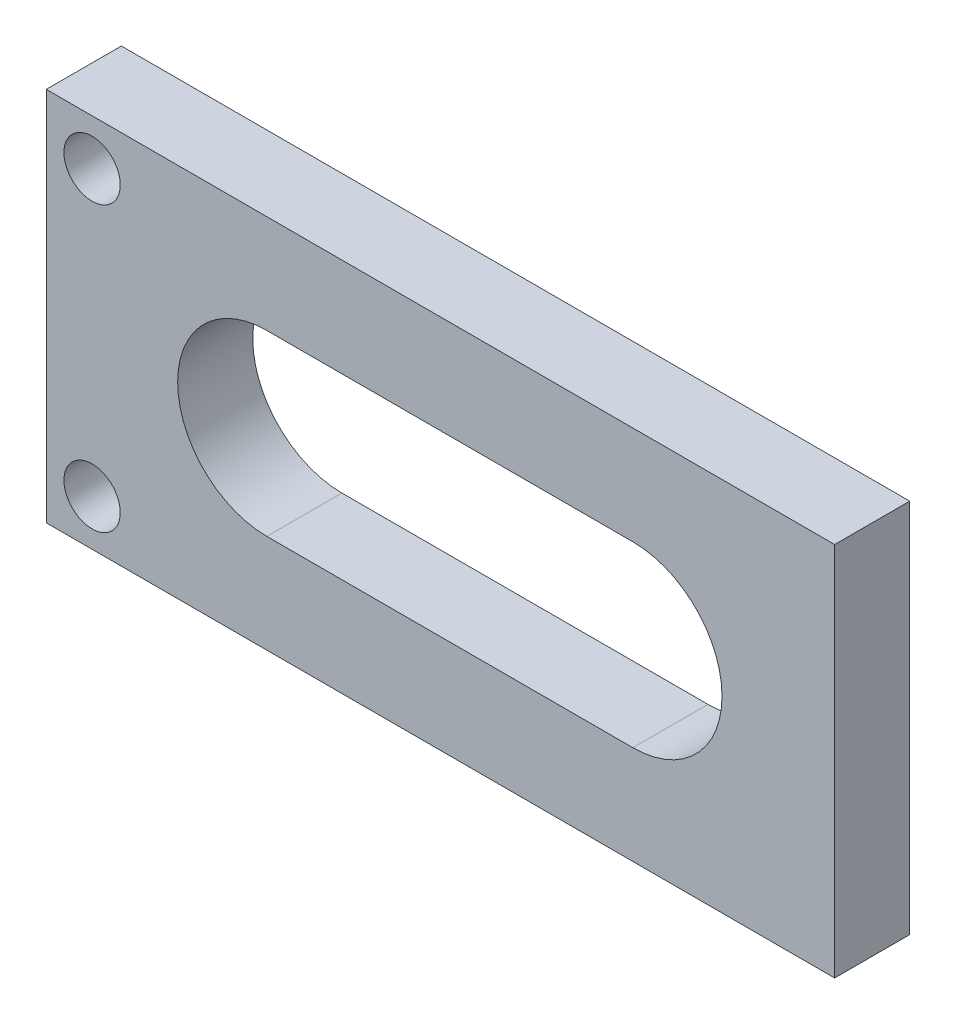
from build123d import *

# Parameters (mm, degrees)
SKETCH1_W           = 42
SKETCH1_H           = 20
SKETCH1_R           = 1.5
BOSS_EXTRUDE1_DEPTH = 4


with BuildPart() as part:
    # Sketch1 → Boss-Extrude1 (new body)
    with BuildSketch(Plane.XY):
        Rectangle(SKETCH1_W, SKETCH1_H)
        with Locations((-18.559305938, -7.559305938)):
            Circle(SKETCH1_R, mode=Mode.SUBTRACT)
        with Locations(Location((-18.559305938, 7.559305938, 0), (0, 0, 180))):
            Circle(SKETCH1_R, mode=Mode.SUBTRACT)
        with BuildLine():
            Line((-9.25, 4.75), (10.25, 4.75))
            ThreePointArc((10.25, 4.75), (15, 0), (10.25, -4.75))
            Line((10.25, -4.75), (-9.25, -4.75))
            ThreePointArc((-9.25, -4.75), (-14, 0), (-9.25, 4.75))
        make_face(mode=Mode.SUBTRACT)
    extrude(amount=BOSS_EXTRUDE1_DEPTH)


solid = part.part
